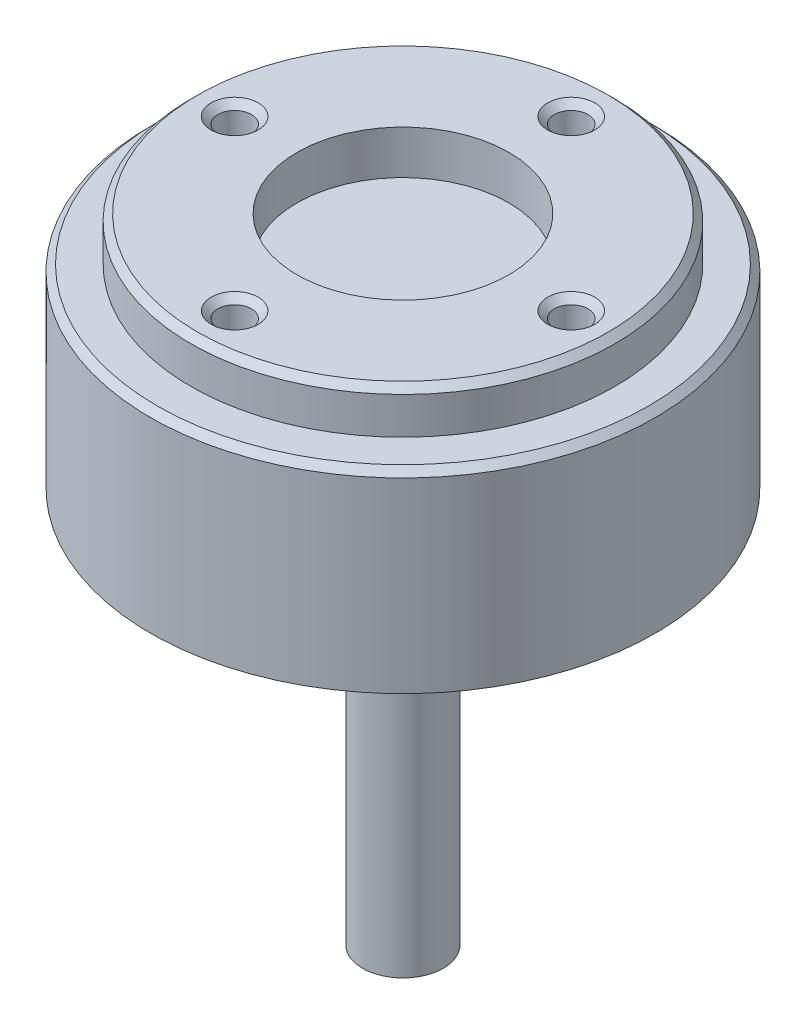
from build123d import *

# Parameters (mm, degrees)
SKETCH1_R           = 37.5
BOSS_EXTRUDE1_DEPTH = 28.75
SKETCH2_R           = 31.5
SKETCH2_R_2         = 15.75
BOSS_EXTRUDE2_DEPTH = 6.5
SKETCH3_R           = 6
BOSS_EXTRUDE3_DEPTH = 58.85
SKETCH4_R           = 7.5
BOSS_EXTRUDE4_DEPTH = 4.7
CHAMFER1_SIZE       = 1
SKETCH5_R           = 2.5
CUT_EXTRUDE1_DEPTH  = 8
CHAMFER2_SIZE       = 1


with BuildPart() as part:
    # Sketch1 → Boss-Extrude1 (new body)
    with BuildSketch(Plane(origin=(0, 0, 0), x_dir=(1, 0, 0), z_dir=(0, 1, 0))):
        with Locations(Location((0, 0, 0), (0, 0, 90))):
            Circle(SKETCH1_R)
    extrude(amount=BOSS_EXTRUDE1_DEPTH)

    # Sketch2 → Boss-Extrude2 (add)
    with BuildSketch(Plane(origin=(0, 28.75, 0), x_dir=(1, 0, 0), z_dir=(0, 1, 0))):
        with Locations(Location((0, 0, 0), (0, 0, 90))):
            Circle(SKETCH2_R)
        with Locations(Location((0, 0, 0), (0, 0, 90))):
            Circle(SKETCH2_R_2, mode=Mode.SUBTRACT)
    extrude(amount=BOSS_EXTRUDE2_DEPTH)

    # Sketch3 → Boss-Extrude3 (add)
    with BuildSketch(Plane.XZ):
        with Locations(Location((0, 0, 0), (0, 0, 270))):
            Circle(SKETCH3_R)
    extrude(amount=BOSS_EXTRUDE3_DEPTH)

    # Sketch4 → Boss-Extrude4 (add)
    with BuildSketch(Plane.XZ):
        with Locations(Location((0, 0, 0), (0, 0, 90))):
            Circle(SKETCH4_R)
    extrude(amount=BOSS_EXTRUDE4_DEPTH)

    # Chamfer1
    chamfer1_edges = [part.edges().sort_by_distance(p)[0] for p in [
        (0, 28.75, 37.5),
        (0, 35.25, 31.5),
    ]]
    chamfer(chamfer1_edges, length=CHAMFER1_SIZE)

    # Sketch5 → Cut-Extrude1 (cut)
    with BuildSketch(Plane(origin=(0, 35.25, 0), x_dir=(1, 0, 0), z_dir=(0, 1, 0))):
        with Locations(Location((0, 25, 0), (0, 0, 270))):
            Circle(SKETCH5_R)
        with Locations(Location((25, 0, 0), (0, 0, 270))):
            Circle(SKETCH5_R)
        with Locations(Location((0, -25, 0), (0, 0, 270))):
            Circle(SKETCH5_R)
        with Locations(Location((-25, 0, 0), (0, 0, 270))):
            Circle(SKETCH5_R)
    extrude(amount=-CUT_EXTRUDE1_DEPTH, mode=Mode.SUBTRACT)

    # Chamfer2
    chamfer2_edges = [part.edges().sort_by_distance(p)[0] for p in [
        (0, 35.25, -27.5),
        (25, 35.25, -2.5),
        (0, 35.25, 22.5),
        (-25, 35.25, -2.5),
    ]]
    chamfer(chamfer2_edges, length=CHAMFER2_SIZE)


solid = part.part
